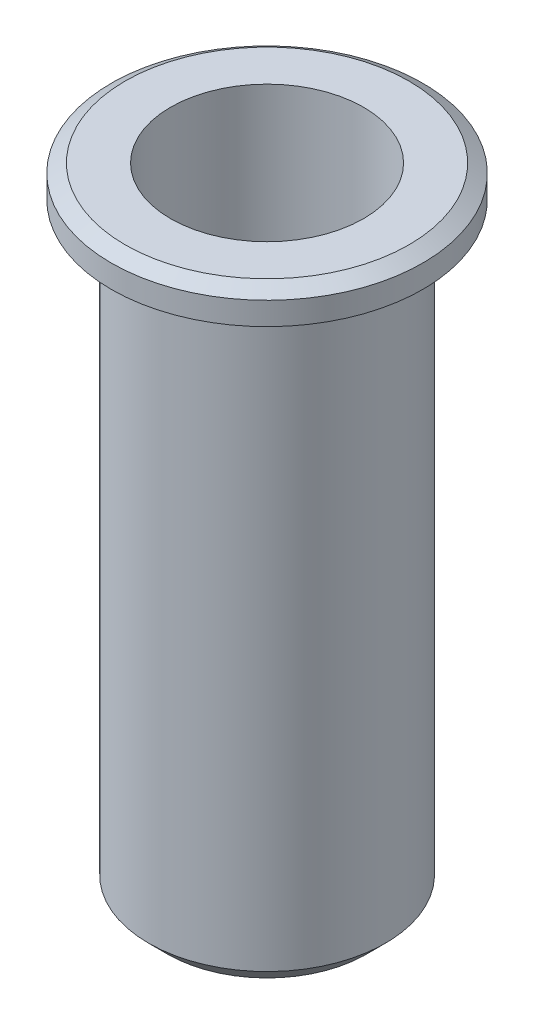
from build123d import *


with BuildPart() as part:
    # Sketch1 → Revolve1 (revolve)
    with BuildSketch(Plane.XY, mode=Mode.PRIVATE) as revolve1_sk:
        Polygon((2.2987, 0), (3.988, 0), (4.75, 0.762), (4.75, 24.2316), (6.25, 24.2316), (6.25, 25.147912088), (5.692861282, 25.5016), (3.8735, 25.5016), (3.8735, 2.365234385), (2.2987, 2.365234385), align=None)
    revolve(revolve1_sk.sketch.rotate(Axis((0, 25.147912088, 0), (0, -1, 0)), 90), axis=Axis((0, 25.147912088, 0), (0, -1, 0)))


solid = part.part
